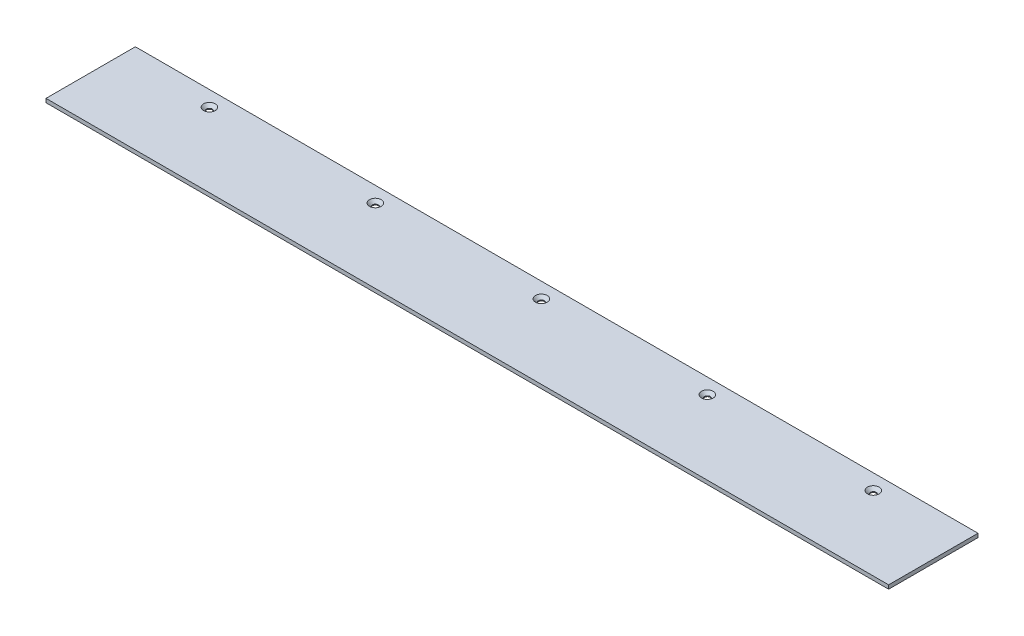
from build123d import *

# Parameters (mm, degrees)
SKETCH1_W           = 660
SKETCH1_H           = 70
BOSS_EXTRUDE1_DEPTH = 3
LPATTERN1_COUNT     = 5
LPATTERN1_PITCH     = 130


with BuildPart() as part:
    # Sketch1 → Boss-Extrude1 (new body)
    with BuildSketch(Plane(origin=(0, 0, 0), x_dir=(1, 0, 0), z_dir=(0, 1, 0))):
        Rectangle(SKETCH1_W, SKETCH1_H)
    extrude(amount=BOSS_EXTRUDE1_DEPTH)

    # Sketch2 → CSK for M4 Hex Socket Countersunk Head Screw1 (revolve, cut)
    with BuildSketch(Plane(origin=(-260, 3, -23), x_dir=(0, 0, 1), z_dir=(1, 0, 0))):
        Polygon((0, 0), (0, 3), (2.25, 3), (2.25, 2.34), (4.59, 0), align=None)
    csk_for_m4_hex_socket_countersunk_head_s = revolve(axis=Axis((-260, 9.35, -23), (0, -1, 0)), mode=Mode.SUBTRACT)

    # LPattern1: CSK for M4 Hex Socket Countersunk Head Screw1 ×5
    with Locations(*[(i * LPATTERN1_PITCH, 0, 0) for i in range(1, LPATTERN1_COUNT)]):
        add(csk_for_m4_hex_socket_countersunk_head_s, mode=Mode.SUBTRACT)


solid = part.part
